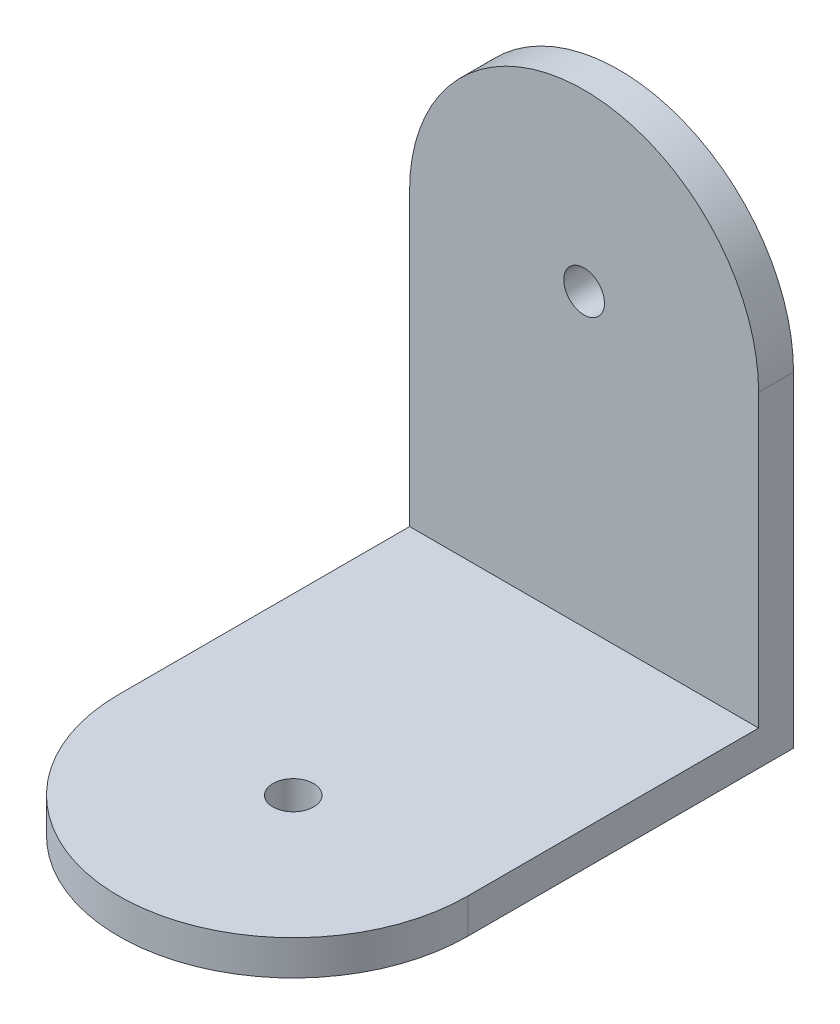
from build123d import *

# Parameters (mm, degrees)
ESBO_O1_R                  = 1.75
RESSALTO_EXTRUS_O1_DEPTH   = 3
ESBO_O2_W                  = 30
ESBO_O2_H                  = 3
RESSALTO_EXTRUS_O2_DEPTH   = 43
CORTE_EXTRUS_O1_DEPTH      = 61.613529843
CORTE_EXTRUS_O1_DEPTH_BACK = 61.613529843
ESBO_O4_R                  = 1.75
CORTE_EXTRUS_O2_DEPTH      = 61.613529843


with BuildPart() as part:
    # Esboço1 → Ressalto-extrusão1 (new body)
    with BuildSketch(Plane.XY):
        with BuildLine():
            Line((-15, 11.357178844), (-15, -13.642821156))
            Line((-15, -13.642821156), (15, -13.642821156))
            Line((15, -13.642821156), (15, 11.357178844))
            ThreePointArc((15, 11.357178844), (0, 26.357178844), (-15, 11.357178844))
        make_face()
        with Locations((0, 11.357178844)):
            Circle(ESBO_O1_R, mode=Mode.SUBTRACT)
    extrude(amount=RESSALTO_EXTRUS_O1_DEPTH)

    # Esboço2 → Ressalto-extrusão2 (add)
    with BuildSketch(Plane(origin=(0, 0, 0), x_dir=(-1, 0, 0), z_dir=(0, 0, -1))):
        with Locations((0, -15.142821156)):
            Rectangle(ESBO_O2_W, ESBO_O2_H)
    extrude(amount=-RESSALTO_EXTRUS_O2_DEPTH)

    # Esboço3 → Corte-extrusão1 (cut, two sides: drawn at the far end of the back side and taken through both)
    with BuildSketch(Plane(origin=(0, -13.642821156, 0), x_dir=(1, 0, 0), z_dir=(0, 1, 0)).offset(-CORTE_EXTRUS_O1_DEPTH_BACK)):
        with BuildLine():
            Line((15, -43), (15, -28))
            ThreePointArc((15, -28), (10.606601736, -38.606601699), (5.3e-08, -43))
            Line((5.3e-08, -43), (15, -43))
        make_face()
        with BuildLine():
            Line((-15, -43), (5.3e-08, -43))
            ThreePointArc((5.3e-08, -43), (-10.606601699, -38.606601736), (-15, -28))
            Line((-15, -28), (-15, -43))
        make_face()
    extrude(amount=CORTE_EXTRUS_O1_DEPTH + CORTE_EXTRUS_O1_DEPTH_BACK, mode=Mode.SUBTRACT)

    # Esboço4 → Corte-extrusão2 (cut, through all)
    with BuildSketch(Plane(origin=(0, -13.642821156, 0), x_dir=(1, 0, 0), z_dir=(0, 1, 0))):
        with Locations(Location((0, -28, 0), (0, 0, 270))):
            Circle(ESBO_O4_R)
    extrude(amount=-CORTE_EXTRUS_O2_DEPTH, mode=Mode.SUBTRACT)


solid = part.part
